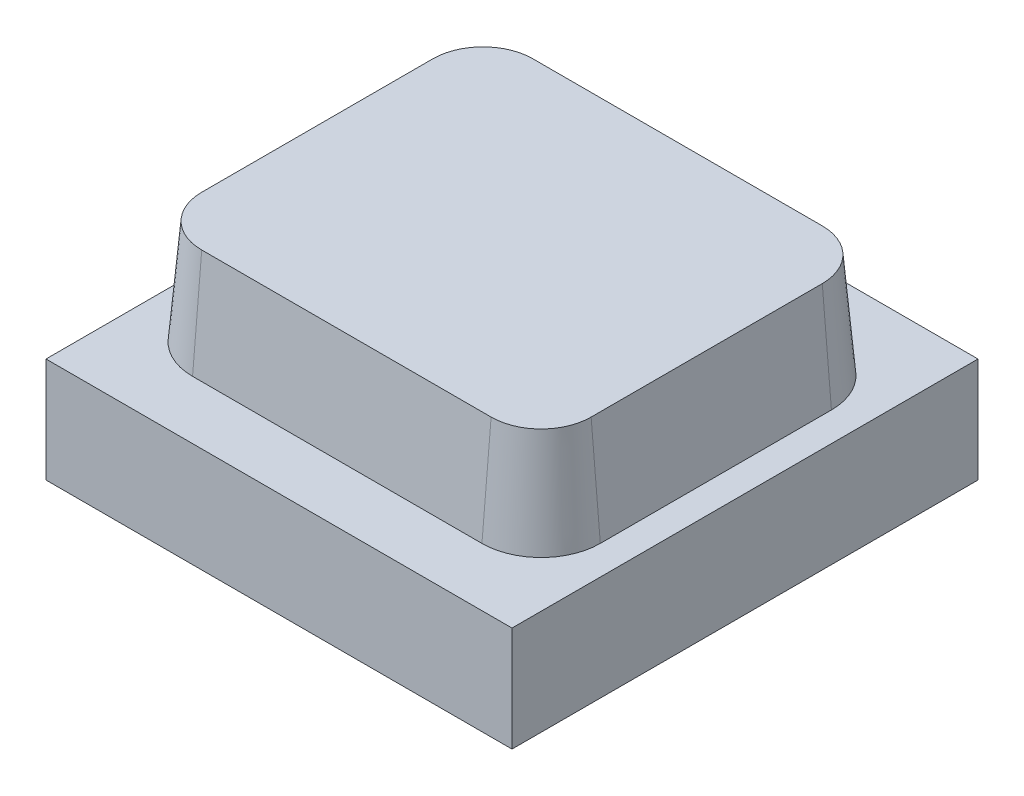
from build123d import *

# Parameters (mm, degrees)
SKETCH1_W           = 2
SKETCH1_H           = 2
BOSS_EXTRUDE1_DEPTH = 0.45
BOSS_EXTRUDE2_DEPTH = 0.45
BOSS_EXTRUDE2_TAPER = 5


with BuildPart() as part:
    # Sketch1 → Boss-Extrude1 (new body)
    with BuildSketch(Plane(origin=(0, 0, 0), x_dir=(1, 0, 0), z_dir=(0, 1, 0))):
        Rectangle(SKETCH1_W, SKETCH1_H)
    extrude(amount=BOSS_EXTRUDE1_DEPTH)


with BuildPart() as body_2:
    # Sketch2 → Boss-Extrude2 (new body)
    with BuildSketch(Plane(origin=(0, 0.45, 0), x_dir=(1, 0, 0), z_dir=(0, 1, 0))):
        with BuildLine():
            ThreePointArc((-0.621, 0.75), (-0.800605122, 0.675605122), (-0.875, 0.496))
            Line((-0.875, 0.496), (-0.875, -0.496))
            ThreePointArc((-0.875, -0.496), (-0.800605122, -0.675605122), (-0.621, -0.75))
            Line((-0.621, -0.75), (0.621, -0.75))
            ThreePointArc((0.621, -0.75), (0.800605122, -0.675605122), (0.875, -0.496))
            Line((0.875, -0.496), (0.875, 0.496))
            ThreePointArc((0.875, 0.496), (0.800605122, 0.675605122), (0.621, 0.75))
            Line((0.621, 0.75), (-0.621, 0.75))
        make_face()
    extrude(amount=BOSS_EXTRUDE2_DEPTH, taper=BOSS_EXTRUDE2_TAPER)


solid = Compound([part.part, body_2.part])
